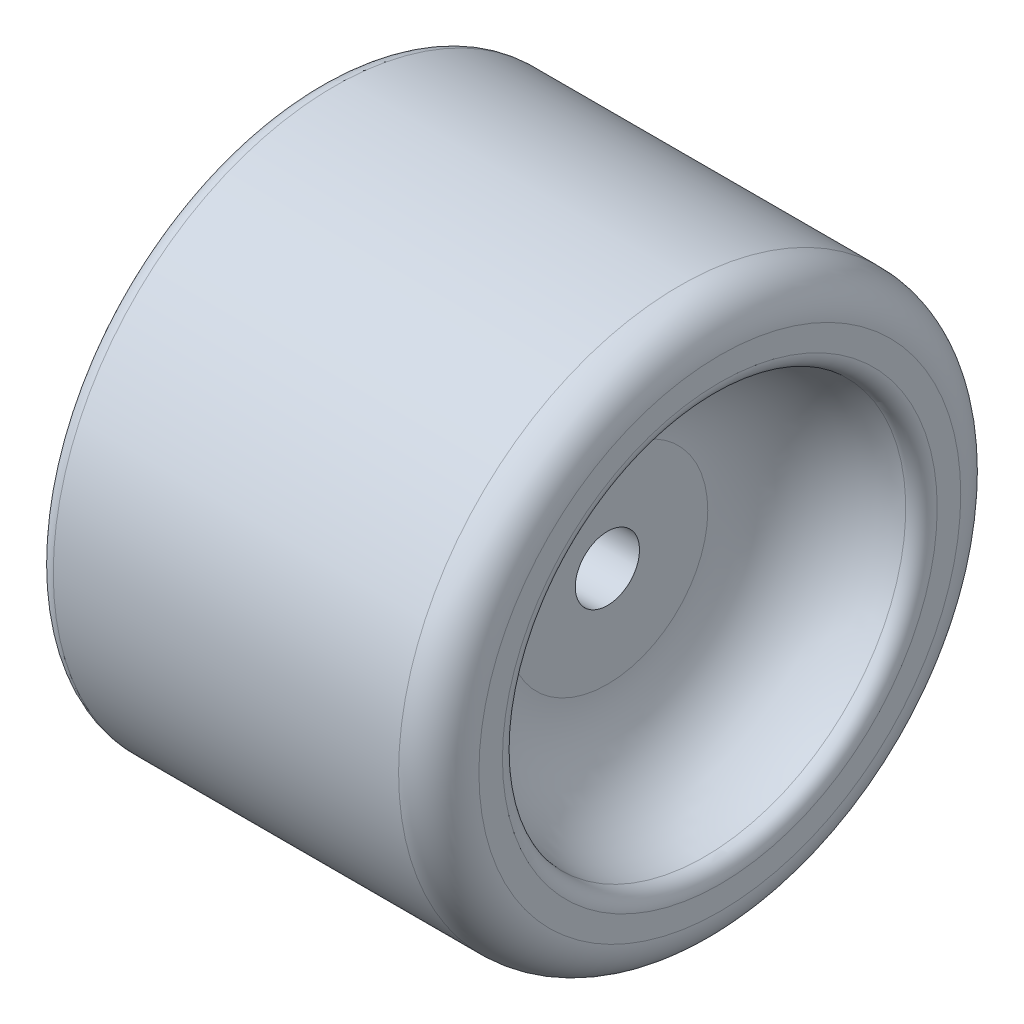
from build123d import *


with BuildPart() as part:
    # Sketch1 → Revolve1 (revolve)
    with BuildSketch(Plane(origin=(0, 0, 0), x_dir=(-1, 0, 0), z_dir=(0, 0, -1)), mode=Mode.PRIVATE) as revolve1_sk:
        with BuildLine():
            Line((0, 4), (22, 4))
            Line((22, 4), (22, 12.5))
            Line((22, 12.5), (24.562401465, 12.5))
            ThreePointArc((24.562401465, 12.5), (24.889670699, 12.62198565), (25.057251332, 12.928420605))
            ThreePointArc((25.057251332, 12.928420605), (28.336858489, 21.346867264), (34.986476907, 27.463127736))
            ThreePointArc((34.986476907, 27.463127736), (35.728142618, 28.19617719), (36, 29.20291603))
            Line((36, 29.20291603), (36, 33))
            ThreePointArc((36, 33), (35.414213562, 34.414213562), (34, 35))
            Line((34, 35), (-9, 35))
            ThreePointArc((-9, 35), (-12.535533906, 33.535533906), (-14, 30))
            Line((-14, 30), (-14, 27.068802284))
            ThreePointArc((-14, 27.068802284), (-13.442084631, 25.683020225), (-12.079608083, 25.070387274))
            ThreePointArc((-12.079608083, 25.070387274), (-3.509387298, 21.216816616), (0, 12.5))
            Line((0, 12.5), (0, 4))
        make_face()
    revolve(revolve1_sk.sketch.rotate(Axis((14.002105865, 0, 0), (-1, 0, 0)), 270), axis=Axis((14.002105865, 0, 0), (-1, 0, 0)))


solid = part.part
